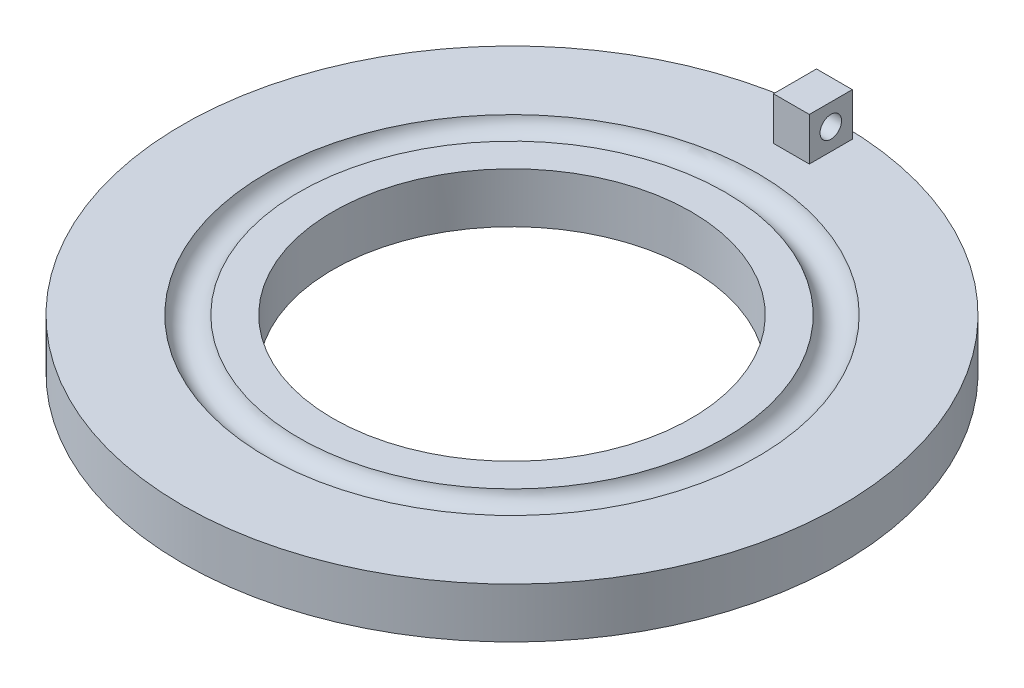
from build123d import *

# Parameters (mm, degrees)
CUT_EXTRUDE1_DEPTH      = 66.429351212
CUT_EXTRUDE1_DEPTH_BACK = 66.429351212
SKETCH4_R               = 25
SKETCH5_W               = 5
SKETCH5_H               = 6
BOSS_EXTRUDE1_DEPTH     = 13
CUT_EXTRUDE2_DEPTH      = 67.340033162
CUT_EXTRUDE2_DEPTH_BACK = 67.340033162
SKETCH6_R               = 1.5


with BuildPart() as part:
    # Sketch3 → Revolve1 (revolve)
    with BuildSketch(Plane.XY, mode=Mode.PRIVATE) as revolve1_sk:
        with BuildLine():
            Line((0, 0), (-29.729399859, 0))
            ThreePointArc((-29.729399859, 0), (-32, 1.825), (-34.270600141, 0))
            Line((-34.270600141, 0), (-46, 0))
            Line((-46, 0), (-46, 7))
            Line((-46, 7), (-34.270600141, 7))
            ThreePointArc((-34.270600141, 7), (-32, 5.175), (-29.729399859, 7))
            Line((-29.729399859, 7), (0, 7))
            Line((0, 7), (0, 0))
        make_face()
    revolve(revolve1_sk.sketch.rotate(Axis((0, 0, 0), (0, 1, 0)), 270), axis=Axis((0, 0, 0), (0, 1, 0)))

    # Sketch4 → Cut-Extrude1 (cut, two sides: drawn at the far end of the back side and taken through both)
    with BuildSketch(Plane(origin=(0, 7, 0), x_dir=(1, 0, 0), z_dir=(0, 1, 0)).offset(-CUT_EXTRUDE1_DEPTH_BACK)):
        with Locations(Location((0, 0, 0), (0, 0, 270))):
            Circle(SKETCH4_R)
    extrude(amount=CUT_EXTRUDE1_DEPTH + CUT_EXTRUDE1_DEPTH_BACK, mode=Mode.SUBTRACT)

    # Sketch5 → Boss-Extrude1 (add)
    with BuildSketch(Plane(origin=(0, 0, 0), x_dir=(1, 0, 0), z_dir=(0, 1, 0))):
        with Locations((0, 42)):
            Rectangle(SKETCH5_W, SKETCH5_H)
    extrude(amount=BOSS_EXTRUDE1_DEPTH)

    # Sketch6 → Cut-Extrude2 (cut, two sides: drawn at the far end of the back side and taken through both)
    with BuildSketch(Plane(origin=(0, 0, 0), x_dir=(0, 0, -1), z_dir=(1, 0, 0)).offset(-CUT_EXTRUDE2_DEPTH_BACK)):
        with Locations((42, 10)):
            Circle(SKETCH6_R)
    extrude(amount=CUT_EXTRUDE2_DEPTH + CUT_EXTRUDE2_DEPTH_BACK, mode=Mode.SUBTRACT)


solid = part.part
